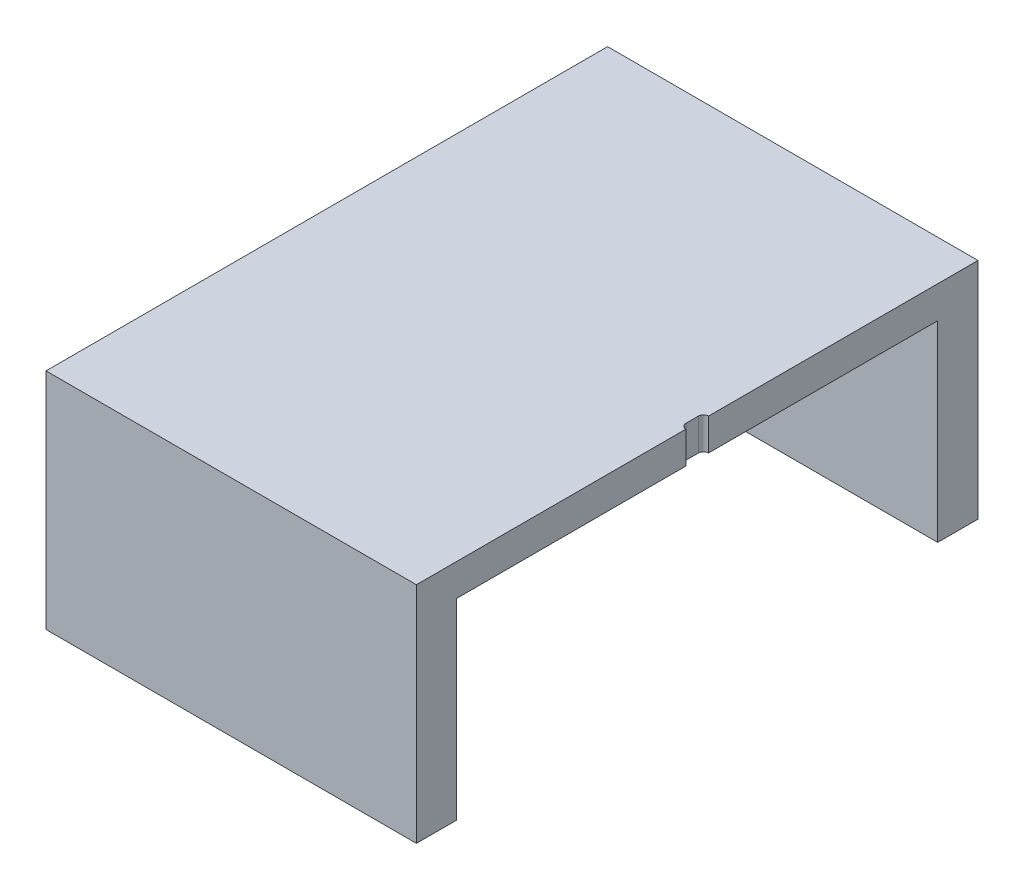
from build123d import *

# Parameters (mm, degrees)
WALL_DEPTH                = 19.05
ROOF_START                = 19.05
ROOF_DEPTH                = 3.175
F_2_56_TAPPED_HOLE1_D     = 1.778
F_2_56_TAPPED_HOLE1_DEPTH = 5.73
F_2_56_TAPPED_HOLE1_TIP   = 0.53416509


with BuildPart() as part:
    # MainSketch → Wall (new body)
    with BuildSketch(Plane(origin=(0, 0, 0), x_dir=(1, 0, 0), z_dir=(0, 1, 0))):
        Polygon((-32.75, -4), (0, -4), (0, 0), (-36.75, 0), (-36.75, -55.72), (0, -55.72), (0, -51.72), (-32.75, -51.72), align=None)
    extrude(amount=WALL_DEPTH)

    # MainSketch<3> → Roof (add)
    with BuildSketch(Plane(origin=(0, 0, 0), x_dir=(1, 0, 0), z_dir=(0, 1, 0)).offset(ROOF_START)):
        with BuildLine():
            Line((0, -26.735), (0, 0))
            Line((0, 0), (-36.75, 0))
            Line((-36.75, 0), (-36.75, -55.72))
            Line((-36.75, -55.72), (0, -55.72))
            Line((0, -55.72), (0, -28.985))
            ThreePointArc((0, -28.985), (-0.353553391, -28.838553391), (-0.5, -28.485))
            Line((-0.5, -28.485), (-0.5, -27.235))
            ThreePointArc((-0.5, -27.235), (-0.353553391, -26.881446609), (0, -26.735))
        make_face()
    extrude(amount=ROOF_DEPTH)

    # #2-56 Tapped Hole1
    with Locations(Plane(origin=(-10, 0, 53.22), x_dir=(0, 0, -1), z_dir=(0, -1, 0))):
        with Locations((0, 0), (0, -24.25), (50.72, -24.25), (50.72, 0)):
            Hole(F_2_56_TAPPED_HOLE1_D / 2, depth=F_2_56_TAPPED_HOLE1_DEPTH)
            with Locations((0, 0, -(F_2_56_TAPPED_HOLE1_DEPTH + F_2_56_TAPPED_HOLE1_TIP / 2))):  # 118° drill point
                Cone(0, F_2_56_TAPPED_HOLE1_D / 2, F_2_56_TAPPED_HOLE1_TIP, mode=Mode.SUBTRACT)


solid = part.part
